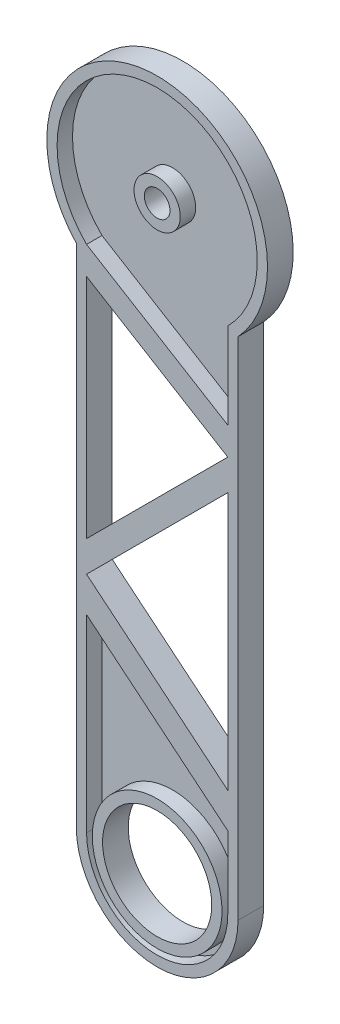
from build123d import *

# Parameters (mm, degrees)
SKETCH1_R           = 13.5
SKETCH1_R_2         = 3.175
BOSS_EXTRUDE1_DEPTH = 6.35
SHELL1_T            = -2.54
BOSS_EXTRUDE2_DEPTH = 3.81
BOSS_EXTRUDE3_DEPTH = 3.81
CUT_EXTRUDE1_DEPTH  = 141.327742832


with BuildPart() as part:
    # Sketch1 → Boss-Extrude1 (new body)
    with BuildSketch(Plane.XY):
        with BuildLine():
            Line((-11.394392523, 89.748598131), (-11.394392523, -35.251401869))
            ThreePointArc((-11.394392523, -35.251401869), (8.605607477, -55.251401869), (28.605607477, -35.251401869))
            Line((28.605607477, -35.251401869), (28.605607477, 89.748598131))
            ThreePointArc((28.605607477, 89.748598131), (8.605607477, 135.605580593), (-11.394392523, 89.748598131))
        make_face()
        with Locations((8.605607477, -35.251401869)):
            Circle(SKETCH1_R, mode=Mode.SUBTRACT)
        with Locations((8.605607477, 108.315703391)):
            Circle(SKETCH1_R_2, mode=Mode.SUBTRACT)
    extrude(amount=BOSS_EXTRUDE1_DEPTH)

    # Shell1
    shell1_openings = [part.faces().sort_by_distance(p)[0] for p in [
        (8.605607477, 50.282735683, 6.35),
    ]]
    offset(amount=SHELL1_T, openings=shell1_openings, kind=Kind.INTERSECTION)

    # Sketch2 → Boss-Extrude2 (add)
    with BuildSketch(Plane.XY.offset(6.35)):
        Polygon((-8.854392523, 27.76139222), (26.065607477, 62.68139222), (26.065607477, 55.06139222), (-8.854392523, 20.14139222), align=None)
    extrude(amount=-BOSS_EXTRUDE2_DEPTH)

    # Sketch3 → Boss-Extrude3 (add)
    with BuildSketch(Plane.XY.offset(2.54)):
        Polygon((26.065607477, 62.68139222), (-8.854392523, 83.913349477), (-8.854392523, 90.774186309), (26.065607477, 69.542229051), align=None)
        Polygon((-8.854392523, 20.14139222), (26.065607477, -8.685765345), (26.065607477, -17.33689372), (-8.854392523, 11.490263845), align=None)
    extrude(amount=BOSS_EXTRUDE3_DEPTH)

    # Sketch4 → Cut-Extrude1 (cut, through all)
    with BuildSketch(Plane.XY.offset(2.54)):
        Polygon((-8.854392523, 27.76139222), (26.065607477, 62.68139222), (-8.854392523, 83.913349477), align=None)
        Polygon((-8.854392523, 20.14139222), (26.065607477, -8.685765345), (26.065607477, 55.06139222), align=None)
    extrude(amount=-CUT_EXTRUDE1_DEPTH, mode=Mode.SUBTRACT)


solid = part.part
